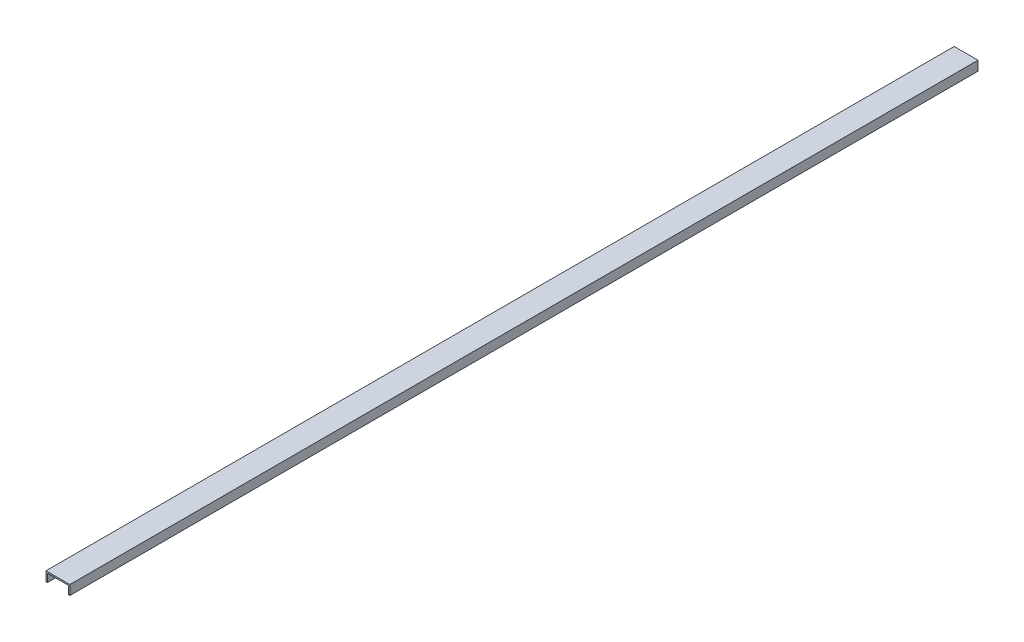
from build123d import *

# Parameters (mm, degrees)
BOSS_EXTRUDE1_DEPTH = 1785
EXTRUDE_R_DEPTH     = 60
EXTRUDE_L_DEPTH     = 60


with BuildPart() as part:
    # Sketch1 → Boss-Extrude1 (new body)
    with BuildSketch(Plane.XY):
        Polygon((0, 0), (0, 20), (50, 20), (50, 0), (47, 0), (47, 17), (3, 17), (3, 0), align=None)
    extrude(amount=BOSS_EXTRUDE1_DEPTH)

    # Sketch2 → Extrude R (add)
    with BuildSketch(Plane.XY.offset(1785)):
        Polygon((0, 0), (0, 20), (50, 20), (50, 0), (47, 0), (47, 17), (3, 17), (3, 0), align=None)
    extrude(amount=EXTRUDE_R_DEPTH)

    # Sketch3 → Extrude L (add)
    with BuildSketch(Plane(origin=(0, 0, 0), x_dir=(-1, 0, 0), z_dir=(0, 0, -1))):
        Polygon((-50, 0), (-50, 20), (0, 20), (0, 0), (-3, 0), (-3, 17), (-47, 17), (-47, 0), align=None)
    extrude(amount=EXTRUDE_L_DEPTH)


solid = part.part
